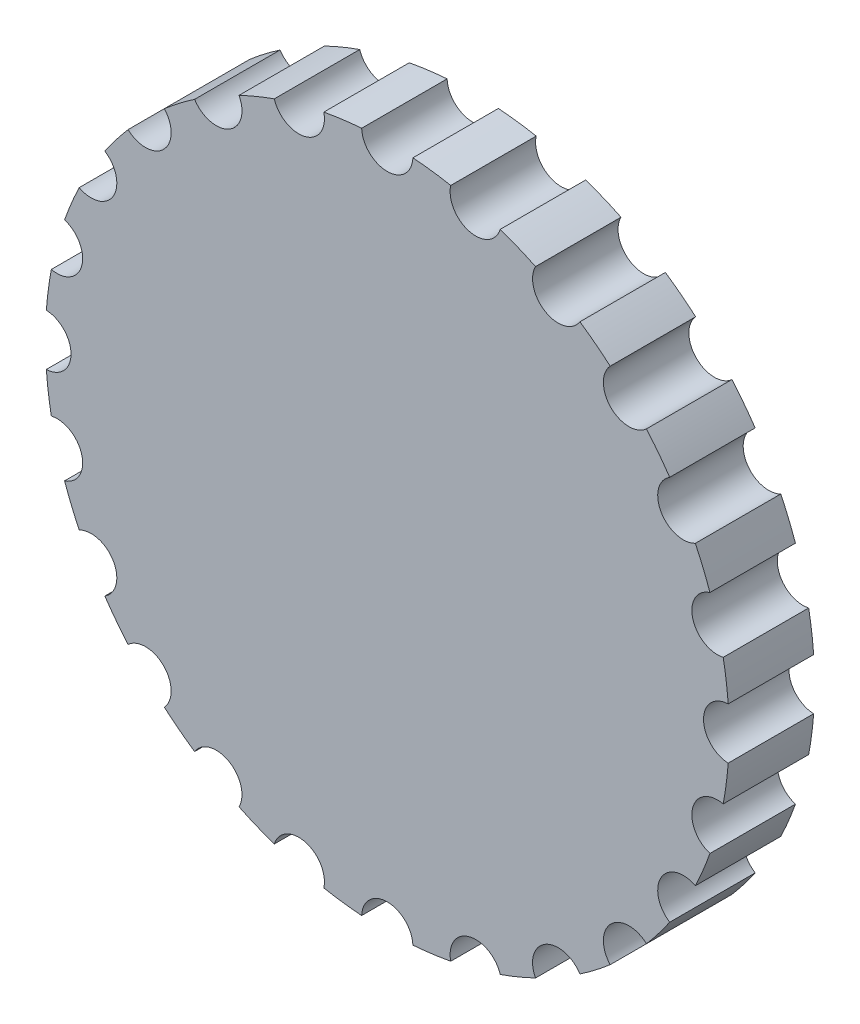
from build123d import *

# Parameters (mm, degrees)
SKETCH1_R           = 20
BOSS_EXTRUDE1_DEPTH = 5
SKETCH3_R           = 1.5
CUT_EXTRUDE1_DEPTH  = 5


with BuildPart() as part:
    # Sketch1 → Boss-Extrude1 (new body)
    with BuildSketch(Plane.XY):
        Circle(SKETCH1_R)
    extrude(amount=BOSS_EXTRUDE1_DEPTH)

    # Sketch3 → Cut-Extrude1 (cut)
    with BuildSketch(Plane.XY.offset(5)):
        with Locations((0, 20)):
            Circle(SKETCH3_R)
        with Locations((5.176380902, 19.318516526)):
            Circle(SKETCH3_R)
        with Locations((10, 17.320508076)):
            Circle(SKETCH3_R)
        with Locations((14.142135624, 14.142135624)):
            Circle(SKETCH3_R)
        with Locations((17.320508076, 10)):
            Circle(SKETCH3_R)
        with Locations((19.318516526, 5.176380902)):
            Circle(SKETCH3_R)
        with Locations((20, 0)):
            Circle(SKETCH3_R)
        with Locations((19.318516526, -5.176380902)):
            Circle(SKETCH3_R)
        with Locations((17.320508076, -10)):
            Circle(SKETCH3_R)
        with Locations((14.142135624, -14.142135624)):
            Circle(SKETCH3_R)
        with Locations((10, -17.320508076)):
            Circle(SKETCH3_R)
        with Locations((5.176380902, -19.318516526)):
            Circle(SKETCH3_R)
        with Locations((0, -20)):
            Circle(SKETCH3_R)
        with Locations((-5.176380902, -19.318516526)):
            Circle(SKETCH3_R)
        with Locations((-10, -17.320508076)):
            Circle(SKETCH3_R)
        with Locations((-14.142135624, -14.142135624)):
            Circle(SKETCH3_R)
        with Locations((-17.320508076, -10)):
            Circle(SKETCH3_R)
        with Locations((-19.318516526, -5.176380902)):
            Circle(SKETCH3_R)
        with Locations((-20, 0)):
            Circle(SKETCH3_R)
        with Locations((-19.318516526, 5.176380902)):
            Circle(SKETCH3_R)
        with Locations((-17.320508076, 10)):
            Circle(SKETCH3_R)
        with Locations((-14.142135624, 14.142135624)):
            Circle(SKETCH3_R)
        with Locations((-10, 17.320508076)):
            Circle(SKETCH3_R)
        with Locations((-5.176380902, 19.318516526)):
            Circle(SKETCH3_R)
    extrude(amount=-CUT_EXTRUDE1_DEPTH, mode=Mode.SUBTRACT)


solid = part.part
